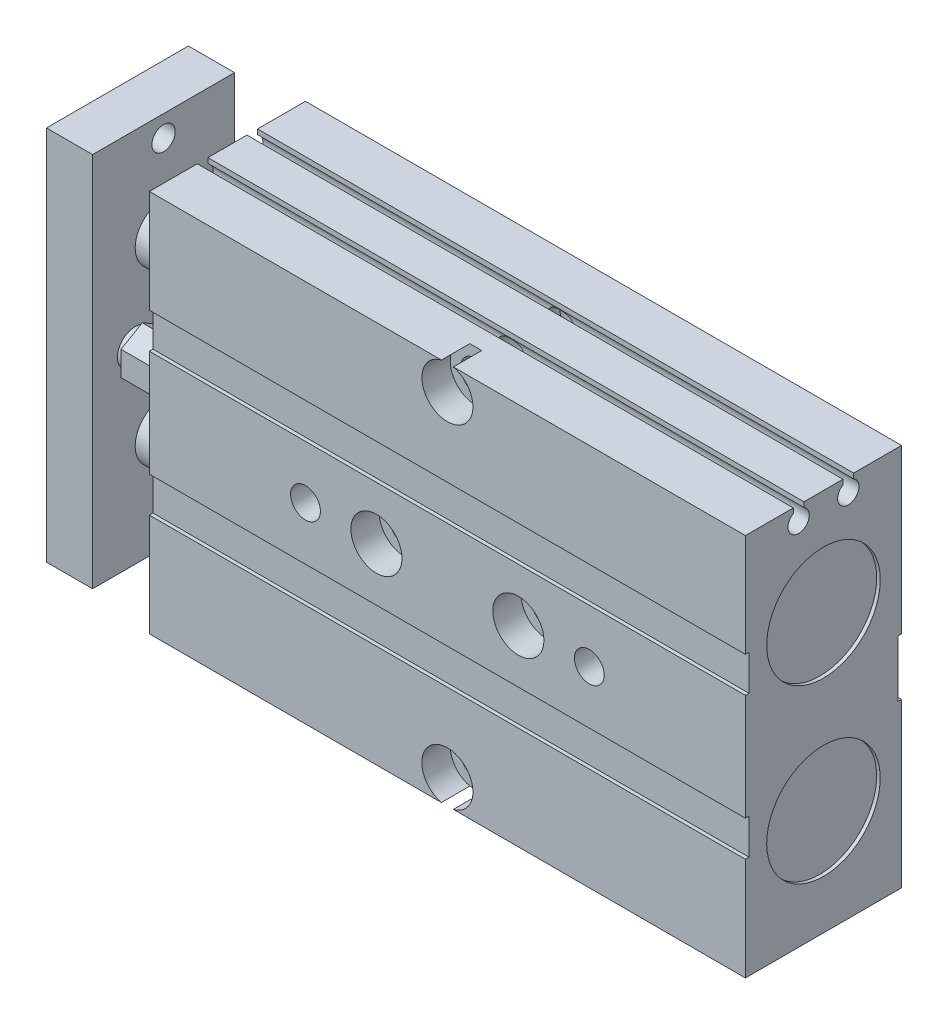
from build123d import *

# Parameters (mm, degrees)
SKETCH_1_W                  = 84
SKETCH_1_H                  = 54
EXTRUDE_1_DEPTH             = 22
EXTRUDE_2_DEPTH             = 4
EXTRUDE_3_DEPTH             = 4
SKETCH_5_R                  = 8
CUT_EXTRUDE_1_DEPTH         = 0.5
CUT_EXTRUDE_START           = -0.5
SKETCH_6_R                  = 8
CUT_EXTRUDE_2_DEPTH         = 0.5
SKETCH_7_R                  = 4
EXTRUDE_4_DEPTH             = 9.5
SKETCH_8_W                  = 20
SKETCH_8_H                  = 53
EXTRUDE_5_DEPTH             = 6.5
SKETCH_9_R                  = 2.5
EXTRUDE_6_DEPTH             = 1
HOLE_WIZARD_M4_2_AT_2_COUNT = 2
HOLE_WIZARD_M4_2_AT_2_PITCH = 47
SKETCH_13_R                 = 1.5
CUT_EXTRUDE_3_DEPTH         = 84
SKETCH_14_W                 = 1.5
SKETCH_14_H                 = 2
CUT_EXTRUDE_4_DEPTH         = 84
HOLE_WIZARD_M5_1_AT_2_COUNT = 2
HOLE_WIZARD_M5_1_AT_2_PITCH = 53
SKETCH_17_W                 = 0.5
SKETCH_17_H                 = 8
SKETCH_17_H_2               = 5
CUT_EXTRUDE_5_DEPTH         = 84
HOLE_WIZARD_M5_2_AT_2_COUNT = 2
HOLE_WIZARD_M5_2_AT_2_PITCH = 40
HOLE_WIZARD_M4_1_AT_2_COUNT = 2
HOLE_WIZARD_M4_1_AT_2_PITCH = 25.539185578
HOLE_WIZARD_M4_1_AT_3_COUNT = 2
HOLE_WIZARD_M4_1_AT_3_PITCH = 25.539185578
HOLE_WIZARD_M4_1_AT_4_COUNT = 2
HOLE_WIZARD_M4_1_AT_4_PITCH = 20
SKETCH_22_R                 = 3.25
CUT_EXTRUDE_10_DEPTH        = 4


with BuildPart() as part:
    # 草图1 → 凸台-拉伸1 (new body)
    with BuildSketch(Plane.XY):
        with Locations((42, 27)):
            Rectangle(SKETCH_1_W, SKETCH_1_H)
    extrude(amount=EXTRUDE_1_DEPTH)

    # 草图5 → 切除-拉伸1 (cut)
    with BuildSketch(Plane.ZY):
        with Locations((11, 39.1)):
            Circle(SKETCH_5_R)
        with Locations(Location((11, 14.9, 0), (0, 0, 180))):
            Circle(SKETCH_5_R)
    extrude(amount=-CUT_EXTRUDE_1_DEPTH, mode=Mode.SUBTRACT)

    # 草图6 → 切除-拉伸2 (cut)
    with BuildSketch(Plane(origin=(84, 0, 0), x_dir=(0, 0, -1), z_dir=(1, 0, 0)).offset(CUT_EXTRUDE_START)):
        with Locations(Location((-11, 39.1, 0), (0, 0, 180))):
            Circle(SKETCH_6_R)
        with Locations((-11, 14.9)):
            Circle(SKETCH_6_R)
    extrude(amount=CUT_EXTRUDE_2_DEPTH, mode=Mode.SUBTRACT)

    # 草图7 → 凸台-拉伸4 (add)
    with BuildSketch(Plane.ZY.offset(-0.5)):
        with Locations((11, 39.1)):
            Circle(SKETCH_7_R)
        with Locations(Location((11, 14.9, 0), (0, 0, 180))):
            Circle(SKETCH_7_R)
    extrude(amount=EXTRUDE_4_DEPTH)

    # 草图8 → 凸台-拉伸5 (add)
    with BuildSketch(Plane.ZY.offset(9)):
        with Locations((11, 27)):
            Rectangle(SKETCH_8_W, SKETCH_8_H)
    extrude(amount=EXTRUDE_5_DEPTH)



with BuildPart() as body_2:
    # 草图2 → 凸台-拉伸2 (new body)
    with BuildSketch(Plane.ZY):
        Polygon((18, 25.267949192), (18, 28.732050808), (15, 30.464101615), (12, 28.732050808), (12, 25.267949192), (15, 23.535898385), align=None)
    extrude(amount=EXTRUDE_2_DEPTH)


with BuildPart() as body_3:
    # 草图4 → 凸台-拉伸3 (new body)
    with BuildSketch(Plane.ZY.offset(4)):
        Polygon((18, 25.267949192), (18, 28.732050808), (15, 30.464101615), (12, 28.732050808), (12, 25.267949192), (15, 23.535898385), align=None)
    extrude(amount=EXTRUDE_3_DEPTH)


with BuildPart() as part_1:
    add(part.part)

    add(body_3.part)  # 凸台-拉伸6 merges body 3
    # 草图9 → 凸台-拉伸6 (add)
    with BuildSketch(Plane(origin=(-9, 0, 0), x_dir=(0, 0, -1), z_dir=(1, 0, 0))):
        with Locations(Location((-15, 27, 0), (0, 0, 180))):
            Circle(SKETCH_9_R)
    extrude(amount=EXTRUDE_6_DEPTH)

    # 草图11 → M4 螺纹孔2 (revolve, cut)
    with BuildSketch(Plane(origin=(-15.5, 50.5, 11), x_dir=(0, 0, 1), z_dir=(0, 1, 0))):
        Polygon((0, 0), (0, 11.091420021), (1.65, 10.1), (1.65, 0), align=None)
    hole_wizard_m4_2 = revolve(axis=Axis((-21.85, 50.5, 11), (1, 0, 0)), mode=Mode.SUBTRACT)

    # M4 螺纹孔2 at 2: M4 螺纹孔2 ×2
    with Locations(*[(0, -i * HOLE_WIZARD_M4_2_AT_2_PITCH, 0) for i in range(1, HOLE_WIZARD_M4_2_AT_2_COUNT)]):
        add(hole_wizard_m4_2, mode=Mode.SUBTRACT)

    # 草图13 → 切除-拉伸3 (cut)
    with BuildSketch(Plane(origin=(84, 0, 0), x_dir=(0, 0, -1), z_dir=(1, 0, 0))):
        with Locations((-14.5, 52)):
            Circle(SKETCH_13_R)
        with Locations((-7.5, 52)):
            Circle(SKETCH_13_R)
    extrude(amount=-CUT_EXTRUDE_3_DEPTH, mode=Mode.SUBTRACT)

    # 草图14 → 切除-拉伸4 (cut)
    with BuildSketch(Plane(origin=(84, 0, 0), x_dir=(0, 0, -1), z_dir=(1, 0, 0))):
        with Locations((-14.5, 53)):
            Rectangle(SKETCH_14_W, SKETCH_14_H)
        with Locations((-7.5, 53)):
            Rectangle(SKETCH_14_W, SKETCH_14_H)
    extrude(amount=-CUT_EXTRUDE_4_DEPTH, mode=Mode.SUBTRACT)

    # 草图15 → M5 螺纹孔1 (revolve, cut)
    with BuildSketch(Plane(origin=(15.5, 0, 12), x_dir=(0, 0, -1), z_dir=(1, 0, 0))):
        Polygon((0, 0), (0, 13.6618073), (2.1, 12.4), (2.1, 0), align=None)
    hole_wizard_m5_1 = revolve(axis=Axis((15.5, -6.35, 12), (0, 1, 0)), mode=Mode.SUBTRACT)

    # M5 螺纹孔1 at 2: M5 螺纹孔1 ×2
    with Locations(*[(i * HOLE_WIZARD_M5_1_AT_2_PITCH, 0, 0) for i in range(1, HOLE_WIZARD_M5_1_AT_2_COUNT)]):
        add(hole_wizard_m5_1, mode=Mode.SUBTRACT)

    # 草图17 → 切除-拉伸5 (cut)
    with BuildSketch(Plane.ZY):
        with Locations((0.25, 27)):
            Rectangle(SKETCH_17_W, SKETCH_17_H)
        with Locations((21.75, 37)):
            Rectangle(SKETCH_17_W, SKETCH_17_H_2)
        with Locations((21.75, 17)):
            Rectangle(SKETCH_17_W, SKETCH_17_H_2)
    extrude(amount=-CUT_EXTRUDE_5_DEPTH, mode=Mode.SUBTRACT)

    # 草图18 → M5 螺纹孔2 (revolve, cut)
    with BuildSketch(Plane(origin=(22, 27, 22), x_dir=(0, -1, 0), z_dir=(1, 0, 0))):
        Polygon((0, 0), (0, 13.6618073), (2.1, 12.4), (2.1, 0), align=None)
    hole_wizard_m5_2 = revolve(axis=Axis((22, 27, 28.35), (0, 0, -1)), mode=Mode.SUBTRACT)

    # M5 螺纹孔2 at 2: M5 螺纹孔2 ×2
    with Locations(*[(i * HOLE_WIZARD_M5_2_AT_2_PITCH, 0, 0) for i in range(1, HOLE_WIZARD_M5_2_AT_2_COUNT)]):
        add(hole_wizard_m5_2, mode=Mode.SUBTRACT)

    # 草图20 → M4 六角凹头螺钉的柱形沉头孔1 (revolve, cut)
    with BuildSketch(Plane(origin=(32, 27, 22), x_dir=(0, -1, 0), z_dir=(1, 0, 0))):
        Polygon((0, 0), (0, 22), (2.15, 22), (2.15, 4), (3.6, 4), (3.6, 0), align=None)
    hole_wizard_m4_1 = revolve(axis=Axis((32, 27, 28.35), (0, 0, -1)), mode=Mode.SUBTRACT)

    # M4 六角凹头螺钉的柱形沉头孔1 at 2: M4 六角凹头螺钉的柱形沉头孔1 ×2
    with Locations(*[Vector(0.3915551640972675, 0.9201546356285785, 0) * (i * HOLE_WIZARD_M4_1_AT_2_PITCH) for i in range(1, HOLE_WIZARD_M4_1_AT_2_COUNT)]):
        add(hole_wizard_m4_1, mode=Mode.SUBTRACT)

    # M4 六角凹头螺钉的柱形沉头孔1 at 3: M4 六角凹头螺钉的柱形沉头孔1 ×2
    with Locations(*[Vector(0.3915551640972674, -0.9201546356285785, 0) * (i * HOLE_WIZARD_M4_1_AT_3_PITCH) for i in range(1, HOLE_WIZARD_M4_1_AT_3_COUNT)]):
        add(hole_wizard_m4_1, mode=Mode.SUBTRACT)

    # M4 六角凹头螺钉的柱形沉头孔1 at 4: M4 六角凹头螺钉的柱形沉头孔1 ×2
    with Locations(*[(i * HOLE_WIZARD_M4_1_AT_4_PITCH, 0, 0) for i in range(1, HOLE_WIZARD_M4_1_AT_4_COUNT)]):
        add(hole_wizard_m4_1, mode=Mode.SUBTRACT)

    # 草图22 → 切除-拉伸10 (cut)
    with BuildSketch(Plane(origin=(0, 0, 0), x_dir=(-1, 0, 0), z_dir=(0, 0, -1))):
        with Locations((-42, 50.5)):
            Circle(SKETCH_22_R)
        with Locations((-32, 27)):
            Circle(SKETCH_22_R)
        with Locations((-52, 27)):
            Circle(SKETCH_22_R)
        with Locations((-42, 3.5)):
            Circle(SKETCH_22_R)
    extrude(amount=-CUT_EXTRUDE_10_DEPTH, mode=Mode.SUBTRACT)


solid = Compound([body_2.part, part_1.part])
